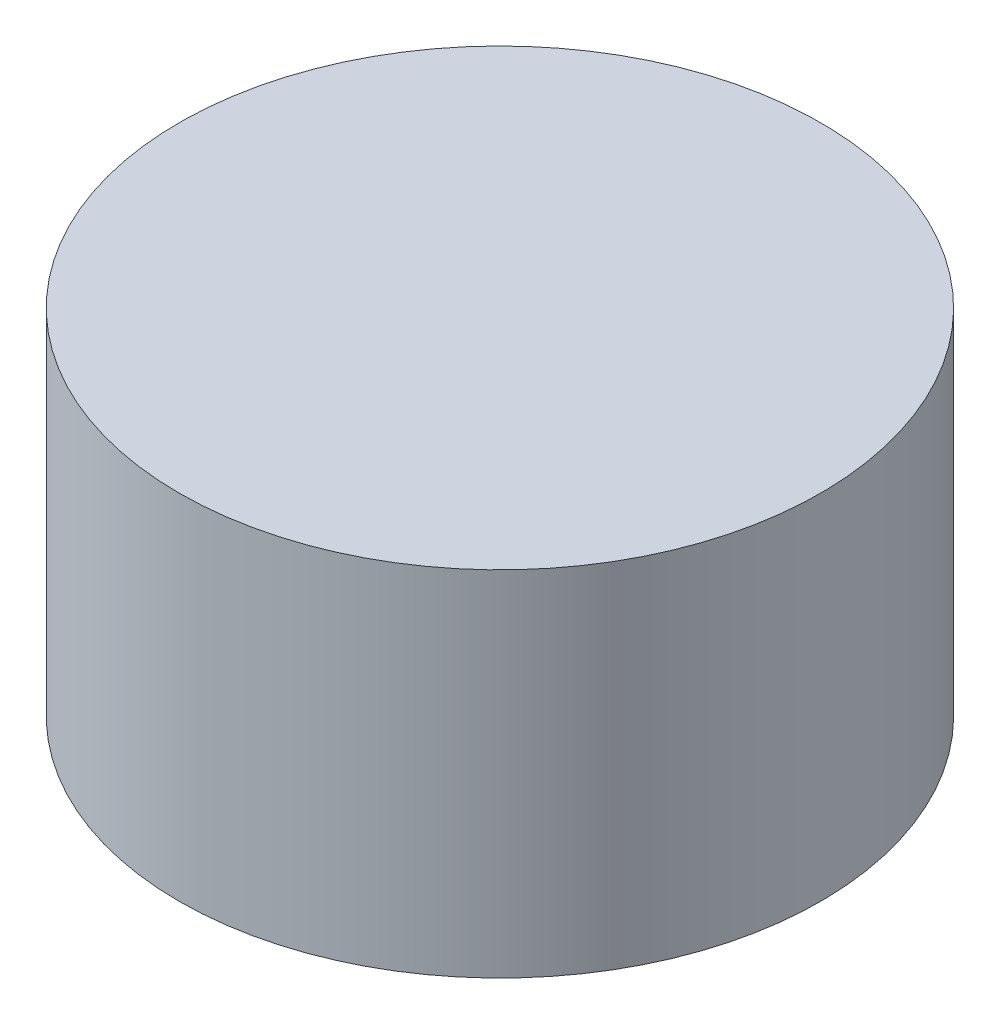
from build123d import *

# Parameters (mm, degrees)
SKETCH1_R           = 31.115
BOSS_EXTRUDE1_DEPTH = 34.29


with BuildPart() as part:
    # Sketch1 → Boss-Extrude1 (new body)
    with BuildSketch(Plane(origin=(0, 0, 0), x_dir=(1, 0, 0), z_dir=(0, 1, 0))):
        with Locations(Location((0, 0, 0), (0, 0, 270))):
            Circle(SKETCH1_R)
    extrude(amount=BOSS_EXTRUDE1_DEPTH)


solid = part.part
